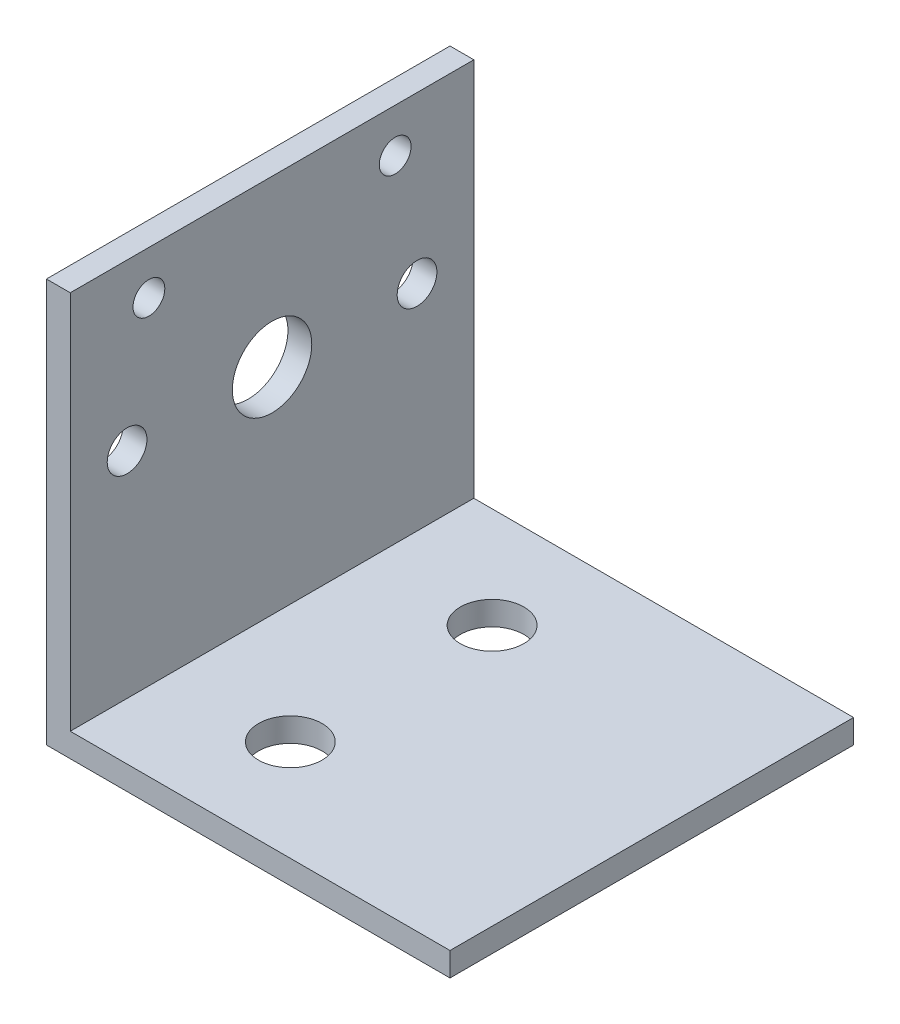
from build123d import *

# Parameters (mm, degrees)
EXTRUDE_THIN1_DEPTH = 25.4
CUT_EXTRUDE1_REACH  = 78.2
SKETCH2_R           = 2.5
SKETCH2_R_2         = 5
CUT_EXTRUDE2_REACH  = 78.2
SKETCH3_R           = 4
CUT_EXTRUDE3_REACH  = 78.2
SKETCH4_R           = 2


with BuildPart() as part:
    # Sketch1 → Extrude-Thin1 (new, symmetric)
    with BuildSketch(Plane.XY):
        Polygon((50.8, 0), (0, 0), (0, 50.8), (3, 50.8), (3, 3), (50.8, 3), align=None)
    extrude(amount=EXTRUDE_THIN1_DEPTH, both=True)

    # Sketch2 → Cut-Extrude1 (cut, up to next)
    with BuildSketch(Plane.ZY, mode=Mode.PRIVATE) as cut_extrude1_sk1:
        with Locations((-18.25, 30)):
            Circle(SKETCH2_R)
    cut_extrude1_tool1 = extrude(cut_extrude1_sk1.sketch, amount=-CUT_EXTRUDE1_REACH, mode=Mode.PRIVATE) & part.part
    # Sketch2 → Cut-Extrude1 (cut, up to next)
    with BuildSketch(Plane.ZY, mode=Mode.PRIVATE) as cut_extrude1_sk2:
        with Locations((18.25, 30)):
            Circle(SKETCH2_R)
    cut_extrude1_tool2 = extrude(cut_extrude1_sk2.sketch, amount=-CUT_EXTRUDE1_REACH, mode=Mode.PRIVATE) & part.part
    # Sketch2 → Cut-Extrude1 (cut, up to next)
    with BuildSketch(Plane.ZY, mode=Mode.PRIVATE) as cut_extrude1_sk3:
        with Locations((0, 30)):
            Circle(SKETCH2_R_2)
    cut_extrude1_tool3 = extrude(cut_extrude1_sk3.sketch, amount=-CUT_EXTRUDE1_REACH, mode=Mode.PRIVATE) & part.part
    add(cut_extrude1_tool1.solids().sort_by_distance((0, 30, -18.25))[0], mode=Mode.SUBTRACT)
    add(cut_extrude1_tool2.solids().sort_by_distance((0, 30, 18.25))[0], mode=Mode.SUBTRACT)
    add(cut_extrude1_tool3.solids().sort_by_distance((0, 30, 0))[0], mode=Mode.SUBTRACT)

    # Sketch3 → Cut-Extrude2 (cut, up to next)
    with BuildSketch(Plane.XZ, mode=Mode.PRIVATE) as cut_extrude2_sk1:
        with Locations(Location((18, 12.7, 0), (0, 0, 270))):
            Circle(SKETCH3_R)
    cut_extrude2_tool1 = extrude(cut_extrude2_sk1.sketch, amount=-CUT_EXTRUDE2_REACH, mode=Mode.PRIVATE) & part.part
    # Sketch3 → Cut-Extrude2 (cut, up to next)
    with BuildSketch(Plane.XZ, mode=Mode.PRIVATE) as cut_extrude2_sk2:
        with Locations(Location((18, -12.7, 0), (0, 0, 270))):
            Circle(SKETCH3_R)
    cut_extrude2_tool2 = extrude(cut_extrude2_sk2.sketch, amount=-CUT_EXTRUDE2_REACH, mode=Mode.PRIVATE) & part.part
    add(cut_extrude2_tool1.solids().sort_by_distance((18, 0, 12.7))[0], mode=Mode.SUBTRACT)
    add(cut_extrude2_tool2.solids().sort_by_distance((18, 0, -12.7))[0], mode=Mode.SUBTRACT)

    # Sketch4 → Cut-Extrude3 (cut, up to next)
    with BuildSketch(Plane.ZY, mode=Mode.PRIVATE) as cut_extrude3_sk1:
        with Locations((-15.5, 45.3)):
            Circle(SKETCH4_R)
    cut_extrude3_tool1 = extrude(cut_extrude3_sk1.sketch, amount=-CUT_EXTRUDE3_REACH, mode=Mode.PRIVATE) & part.part
    # Sketch4 → Cut-Extrude3 (cut, up to next)
    with BuildSketch(Plane.ZY, mode=Mode.PRIVATE) as cut_extrude3_sk2:
        with Locations((15.5, 45.3)):
            Circle(SKETCH4_R)
    cut_extrude3_tool2 = extrude(cut_extrude3_sk2.sketch, amount=-CUT_EXTRUDE3_REACH, mode=Mode.PRIVATE) & part.part
    add(cut_extrude3_tool1.solids().sort_by_distance((0, 45.3, -15.5))[0], mode=Mode.SUBTRACT)
    add(cut_extrude3_tool2.solids().sort_by_distance((0, 45.3, 15.5))[0], mode=Mode.SUBTRACT)


solid = part.part
